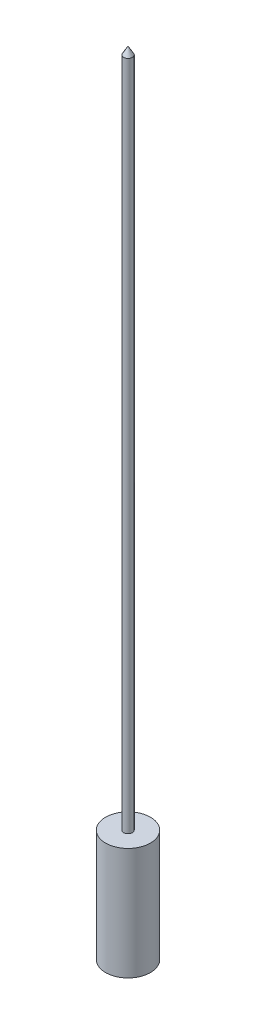
from build123d import *

# Parameters (mm, degrees)
SKETCH2_W           = 0.5
SKETCH2_H           = 76.000000146
SKETCH3_R           = 2.54
BOSS_EXTRUDE2_DEPTH = 12.7


with BuildPart() as part:
    # Sketch2 → Revolve1 (revolve)
    with BuildSketch(Plane(origin=(0, 0, 0), x_dir=(0, 0, -1), z_dir=(1, 0, 0))):
        with Locations((0.25, 38.000000073)):
            Rectangle(SKETCH2_W, SKETCH2_H)
        Polygon((0, 76.86602555), (0.5, 76.000000146), (0, 76.000000146), align=None)
    revolve(axis=Axis((0, 0, 0), (0, 1, 0)))

    # Sketch3 → Boss-Extrude2 (add)
    with BuildSketch(Plane(origin=(0, 0, 0), x_dir=(-1, 0, 0), z_dir=(0, -1, 0))):
        with Locations(Location((0, 0, 0), (0, 0, 90))):
            Circle(SKETCH3_R)
    extrude(amount=BOSS_EXTRUDE2_DEPTH)


solid = part.part
